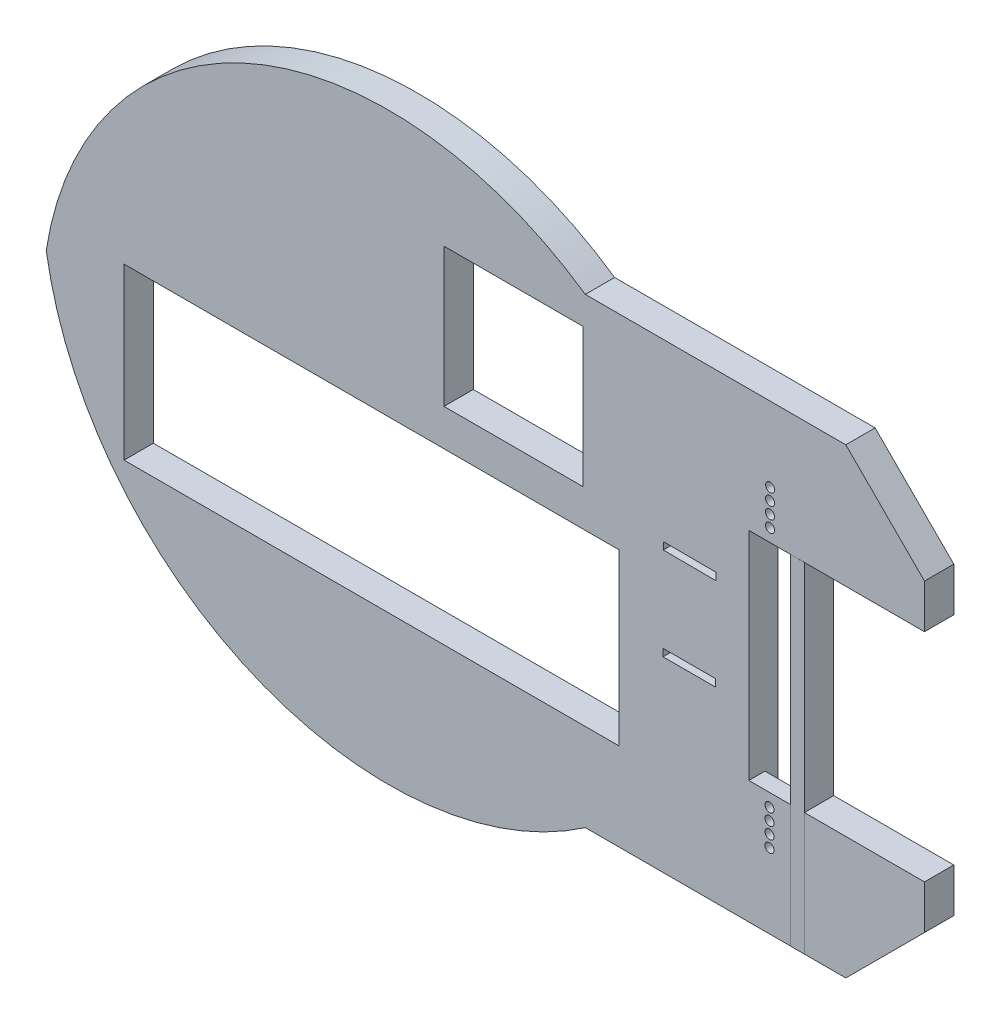
from build123d import *

# Parameters (mm, degrees)
BOSS_EXTRUDE1_DEPTH      = 10
BOSS_EXTRUDE1_DEPTH_BACK = 0.01
SKETCH7_W                = 169
SKETCH7_H                = 58
CUT_EXTRUDE4_DEPTH       = 261.116514656
SKETCH18_W               = 47.4
SKETCH18_H               = 47.4
CUT_EXTRUDE18_DEPTH      = 261.116514656
SKETCH28_W               = 4.75290021
SKETCH28_H               = 9.947843747
BOSS_EXTRUDE6_DEPTH      = 115.870057685
SKETCH30_W               = 14.12
SKETCH30_H               = 25
CUT_EXTRUDE25_DEPTH      = 4.5
SKETCH33_R               = 1.55
CUT_EXTRUDE26_DEPTH      = 10.01
SKETCH44_W               = 18
SKETCH44_H               = 2.51
CUT_EXTRUDE30_DEPTH      = 10.01


with BuildPart() as part:
    # Sketch1 → Boss-Extrude1 (new, two sides: drawn at the far end of the back side and taken through both)
    with BuildSketch(Plane.XY.offset(-BOSS_EXTRUDE1_DEPTH_BACK)):
        with BuildLine():
            Line((0, 0), (0, -37))
            Line((0, -37), (60, -37))
            Line((60, -37), (60, -52))
            Line((60, -52), (33.129942315, -78.870057685))
            Line((33.129942315, -78.870057685), (-55.850057685, -78.870057685))
            ThreePointArc((-55.850057685, -78.870057685), (-169.614041234, -90.257166815), (-239.999947532, -0.158696229))
            ThreePointArc((-239.999947532, -0.158696229), (-169.748285548, 90.207490359), (-55.850057685, 78.870057685))
            Line((-55.850057685, 78.870057685), (33.129942315, 78.870057685))
            Line((33.129942315, 78.870057685), (60, 52))
            Line((60, 52), (60, 37))
            Line((60, 37), (0, 37))
            Line((0, 37), (0, 0))
        make_face()
    extrude(amount=BOSS_EXTRUDE1_DEPTH + BOSS_EXTRUDE1_DEPTH_BACK)

    # Sketch7 → Cut-Extrude4 (cut, through all)
    with BuildSketch(Plane.XY.offset(10)):
        with Locations((-128.91309413, -19.94383898)):
            Rectangle(SKETCH7_W, SKETCH7_H)
    extrude(amount=-CUT_EXTRUDE4_DEPTH, mode=Mode.SUBTRACT)

    # Sketch18 → Cut-Extrude18 (cut, through all)
    with BuildSketch(Plane.XY.offset(10)):
        with Locations((-80.42454895, 45.3)):
            Rectangle(SKETCH18_W, SKETCH18_H)
    extrude(amount=-CUT_EXTRUDE18_DEPTH, mode=Mode.SUBTRACT)

    # Sketch28 → Boss-Extrude6 (add)
    with BuildSketch(Plane.XZ.offset(78.870057685)):
        with Locations((16.603067585, 5.033719824)):
            Rectangle(SKETCH28_W, SKETCH28_H)
    extrude(amount=-BOSS_EXTRUDE6_DEPTH)

    # Sketch30 → Cut-Extrude25 (cut)
    with BuildSketch(Plane(origin=(0, 0, -0.01), x_dir=(-1, 0, 0), z_dir=(0, 0, -1))):
        with Locations((-7.06, -49.5)):
            Rectangle(SKETCH30_W, SKETCH30_H)
        Polygon((-14.38072485, 61.935396467), (-14.275539526, 36.935617747), (-0.155664505, 36.995026418), (-0.260849829, 61.994805138), align=None)
    extrude(amount=-CUT_EXTRUDE25_DEPTH, mode=Mode.SUBTRACT)

    # Sketch33 → Cut-Extrude26 (cut)
    with BuildSketch(Plane(origin=(0, 0, -0.01), x_dir=(-1, 0, 0), z_dir=(0, 0, -1))):
        with Locations((-7.06, -53.4)):
            Circle(SKETCH33_R)
        with Locations((-7.06, -49.4)):
            Circle(SKETCH33_R)
        with Locations((-7.06, -45.4)):
            Circle(SKETCH33_R)
        with Locations((-7.06, -41.4)):
            Circle(SKETCH33_R)
        with Locations((-7.228632788, 41.370889137)):
            Circle(SKETCH33_R)
        with Locations((-7.244931474, 45.370855931)):
            Circle(SKETCH33_R)
        with Locations((-7.261230159, 49.370822725)):
            Circle(SKETCH33_R)
        with Locations((-7.277528845, 53.370789519)):
            Circle(SKETCH33_R)
    extrude(amount=-CUT_EXTRUDE26_DEPTH, mode=Mode.SUBTRACT)

    # Sketch44 → Cut-Extrude30 (cut)
    with BuildSketch(Plane(origin=(0, 0, -0.01), x_dir=(-1, 0, 0), z_dir=(0, 0, -1))):
        with Locations((20.303305502, -13.815974066)):
            Rectangle(SKETCH44_W, SKETCH44_H)
        Polygon((29.23066644, 16.565007379), (29.218146833, 19.074976156), (11.218370746, 18.985194117), (11.230890353, 16.47522534), align=None)
    extrude(amount=-CUT_EXTRUDE30_DEPTH, mode=Mode.SUBTRACT)


solid = part.part
